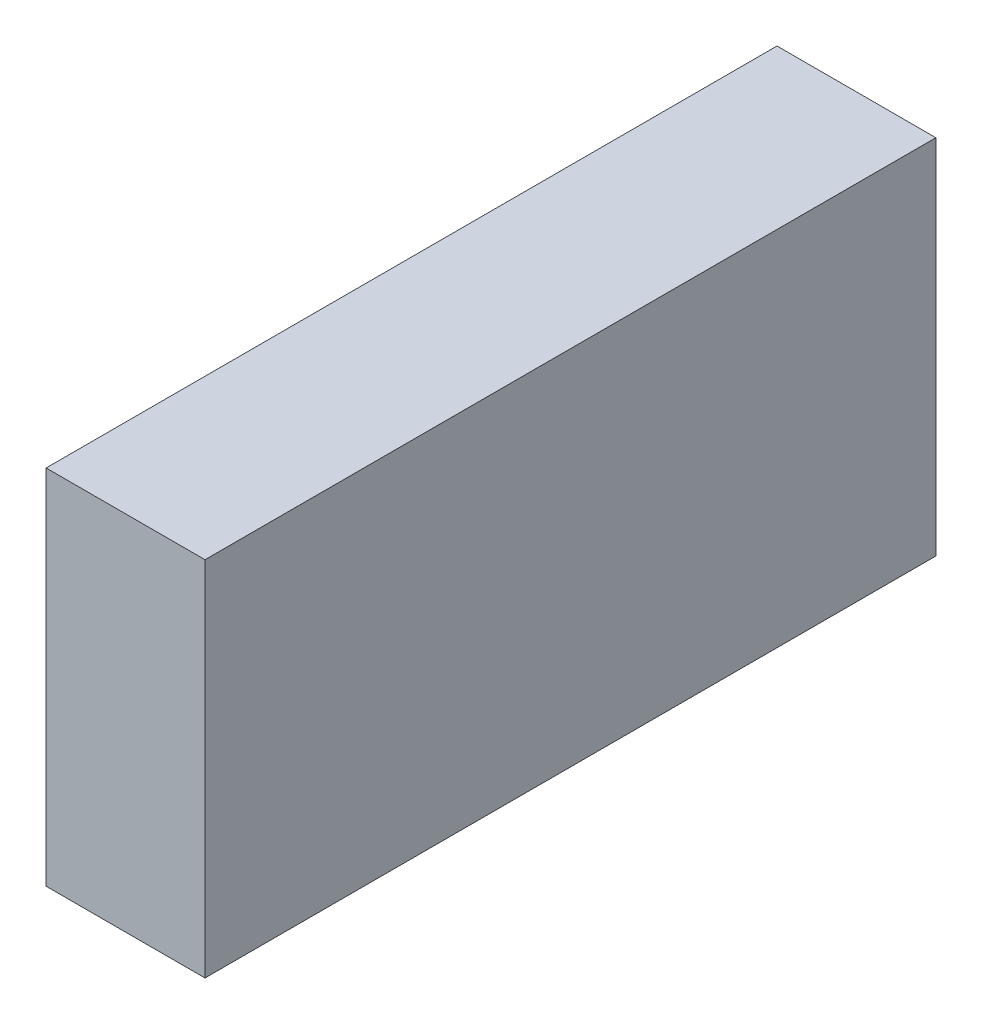
from build123d import *

# Parameters (mm, degrees)
ESBO_O1_W                = 50
ESBO_O1_H                = 114
RESSALTO_EXTRUS_O1_DEPTH = 230


with BuildPart() as part:
    # Esboço1 → Ressalto-extrusão1 (new body)
    with BuildSketch(Plane.XY):
        with Locations((25, 57)):
            Rectangle(ESBO_O1_W, ESBO_O1_H)
    extrude(amount=RESSALTO_EXTRUS_O1_DEPTH)


solid = part.part
